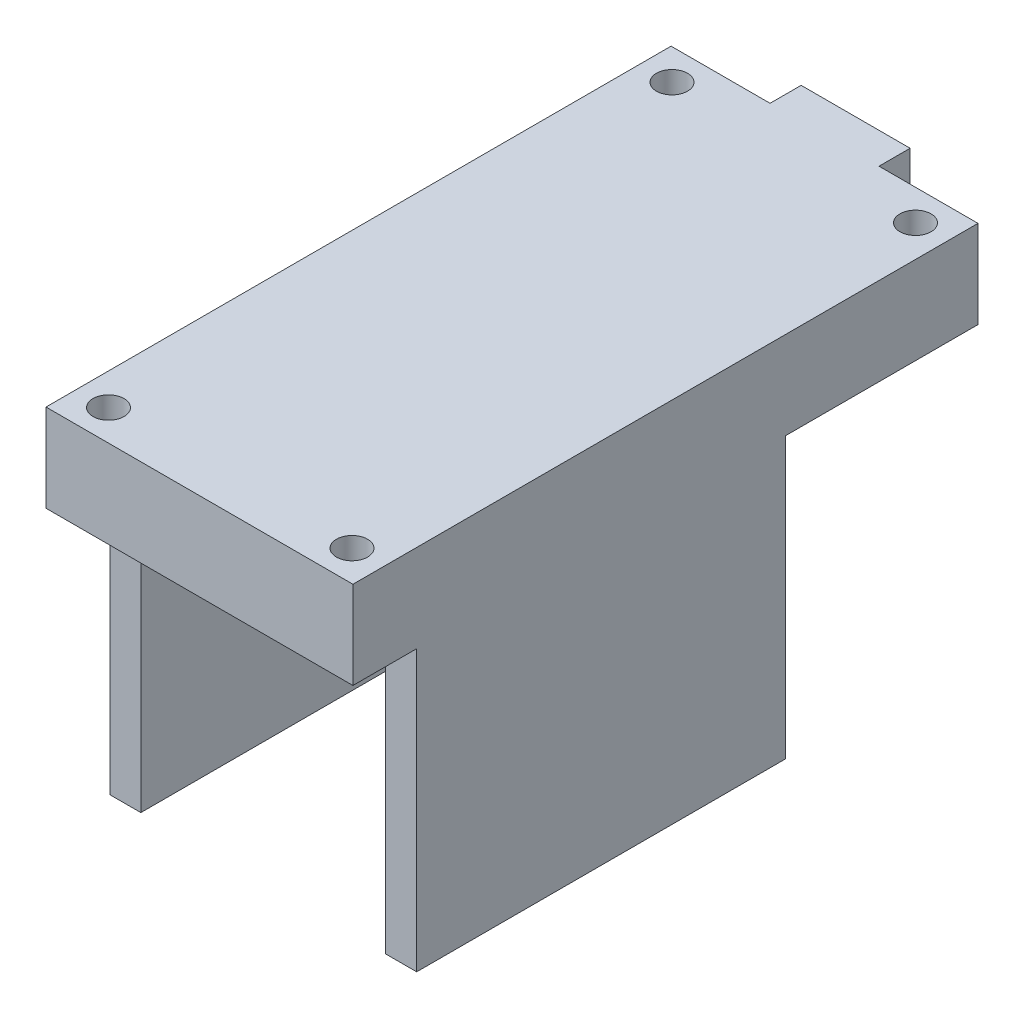
from build123d import *

# Parameters (mm, degrees)
SKETCH1_W           = 25.0698
SKETCH1_H           = 51.054
SKETCH1_R           = 1.27
BOSS_EXTRUDE1_DEPTH = 7.1628
SKETCH2_W           = 2.54
SKETCH2_H           = 40.64
SKETCH2_H_2         = 30.1244
BOSS_EXTRUDE2_DEPTH = 22.86
SKETCH3_W           = 8.9
SKETCH3_H           = 7.1628
BOSS_EXTRUDE3_DEPTH = 2.54


with BuildPart() as part:
    # Sketch1 → Boss-Extrude1 (new body)
    with BuildSketch(Plane(origin=(0, 0, 0), x_dir=(1, 0, 0), z_dir=(0, 1, 0))):
        Rectangle(SKETCH1_W, SKETCH1_H)
        with Locations(Location((9.9441, 23.0124, 0), (0, 0, 270))):
            Circle(SKETCH1_R, mode=Mode.SUBTRACT)
        with Locations(Location((-9.9441, 23.0124, 0), (0, 0, 90))):
            Circle(SKETCH1_R, mode=Mode.SUBTRACT)
        with Locations(Location((9.9441, -23.0124, 0), (0, 0, 90))):
            Circle(SKETCH1_R, mode=Mode.SUBTRACT)
        with Locations(Location((-9.9441, -23.0124, 0), (0, 0, 270))):
            Circle(SKETCH1_R, mode=Mode.SUBTRACT)
    extrude(amount=BOSS_EXTRUDE1_DEPTH)

    # Sketch2 → Boss-Extrude2 (add)
    with BuildSketch(Plane.XZ):
        with Locations((-11.2649, 0)):
            Rectangle(SKETCH2_W, SKETCH2_H)
        with Locations((11.2649, 5.2578)):
            Rectangle(SKETCH2_W, SKETCH2_H_2)
    extrude(amount=BOSS_EXTRUDE2_DEPTH)

    # Sketch3 → Boss-Extrude3 (add)
    with BuildSketch(Plane(origin=(0, 0, -25.527), x_dir=(-1, 0, 0), z_dir=(0, 0, -1))):
        with Locations((0, 3.5814)):
            Rectangle(SKETCH3_W, SKETCH3_H)
    extrude(amount=BOSS_EXTRUDE3_DEPTH)


solid = part.part
